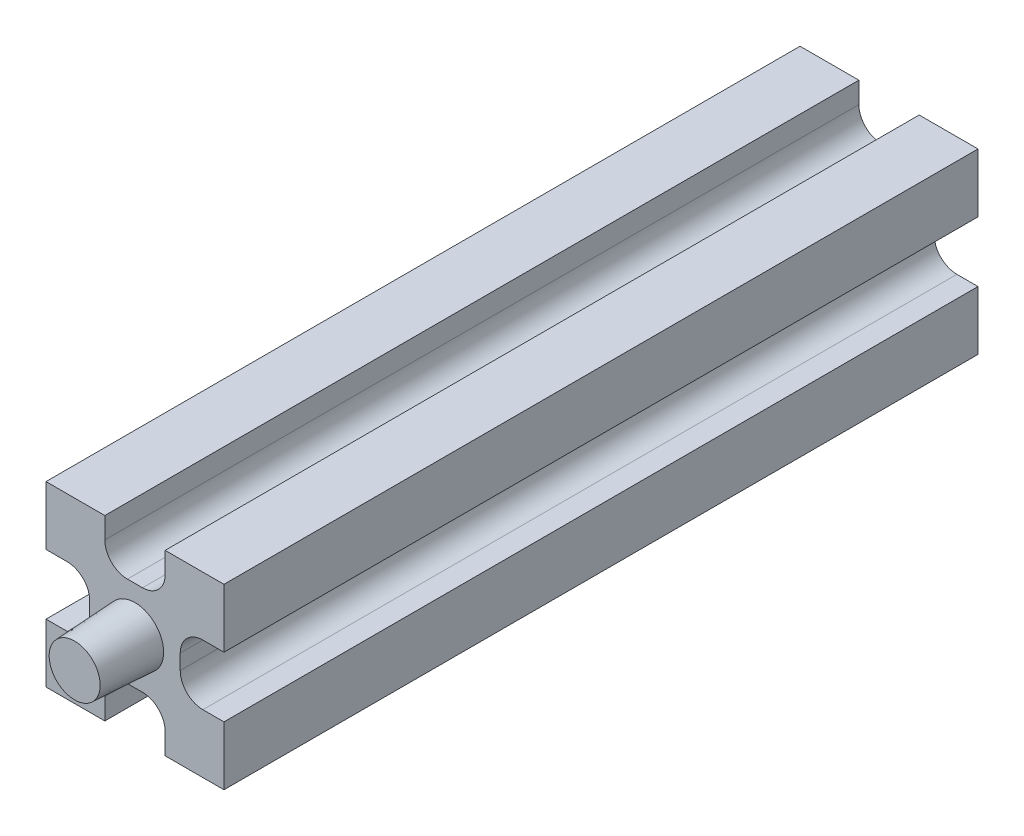
from build123d import *

# Parameters (mm, degrees)
SALIENTE_EXTRUIR1_DEPTH = 50000
CROQUIS1_9_R            = 1900
SALIENTE_EXTRUIR2_DEPTH = 4000
SALIENTE_EXTRUIR2_TAPER = 3


with BuildPart() as part:
    # Croquis1 → Saliente-Extruir1 (new body)
    with BuildSketch(Plane.XY):
        with BuildLine():
            Line((126743.416897498, 163837.836627923), (126743.416897498, 162437.836627923))
            Line((126743.416897498, 162437.836627923), (130643.416897498, 162437.836627923))
            Line((130643.416897498, 162437.836627923), (130643.416897498, 166337.836627923))
            Line((130643.416897498, 166337.836627923), (129243.416897498, 166337.836627923))
            ThreePointArc((129243.416897498, 166337.836627923), (128182.756725718, 166777.176456144), (127743.416897498, 167837.836627923))
            Line((127743.416897498, 167837.836627923), (127743.416897498, 168837.836627923))
            ThreePointArc((127743.416897498, 168837.836627923), (128182.756725718, 169898.496799703), (129243.416897498, 170337.836627923))
            Line((129243.416897498, 170337.836627923), (130643.416897498, 170337.836627923))
            Line((130643.416897498, 170337.836627923), (130643.416897498, 174237.836627923))
            Line((130643.416897498, 174237.836627923), (126743.416897498, 174237.836627923))
            Line((126743.416897498, 174237.836627923), (126743.416897498, 172837.836627923))
            ThreePointArc((126743.416897498, 172837.836627923), (126304.077069278, 171777.176456144), (125243.416897498, 171337.836627923))
            Line((125243.416897498, 171337.836627923), (124243.416897498, 171337.836627923))
            ThreePointArc((124243.416897498, 171337.836627923), (123182.756725718, 171777.176456144), (122743.416897498, 172837.836627923))
            Line((122743.416897498, 172837.836627923), (122743.416897498, 174237.836627923))
            Line((122743.416897498, 174237.836627923), (118843.416897498, 174237.836627923))
            Line((118843.416897498, 174237.836627923), (118843.416897498, 170337.836627923))
            Line((118843.416897498, 170337.836627923), (120243.416897498, 170337.836627923))
            ThreePointArc((120243.416897498, 170337.836627923), (121304.077069278, 169898.496799703), (121743.416897498, 168837.836627923))
            Line((121743.416897498, 168837.836627923), (121743.416897498, 167837.836627923))
            ThreePointArc((121743.416897498, 167837.836627923), (121304.077069278, 166777.176456144), (120243.416897498, 166337.836627923))
            Line((120243.416897498, 166337.836627923), (118843.416897498, 166337.836627923))
            Line((118843.416897498, 166337.836627923), (118843.416897498, 162437.836627923))
            Line((118843.416897498, 162437.836627923), (122743.416897498, 162437.836627923))
            Line((122743.416897498, 162437.836627923), (122743.416897498, 163837.836627923))
            ThreePointArc((122743.416897498, 163837.836627923), (123182.756725718, 164898.496799703), (124243.416897498, 165337.836627923))
            Line((124243.416897498, 165337.836627923), (125243.416897498, 165337.836627923))
            ThreePointArc((125243.416897498, 165337.836627923), (126304.077069278, 164898.496799703), (126743.416897498, 163837.836627923))
        make_face()
    extrude(amount=-SALIENTE_EXTRUIR1_DEPTH)

    # Croquis1<9> → Saliente-Extruir2 (add)
    with BuildSketch(Plane.XY):
        with Locations((124743.416897498, 168337.836627923)):
            Circle(CROQUIS1_9_R)
    extrude(amount=SALIENTE_EXTRUIR2_DEPTH, taper=SALIENTE_EXTRUIR2_TAPER)


solid = part.part
